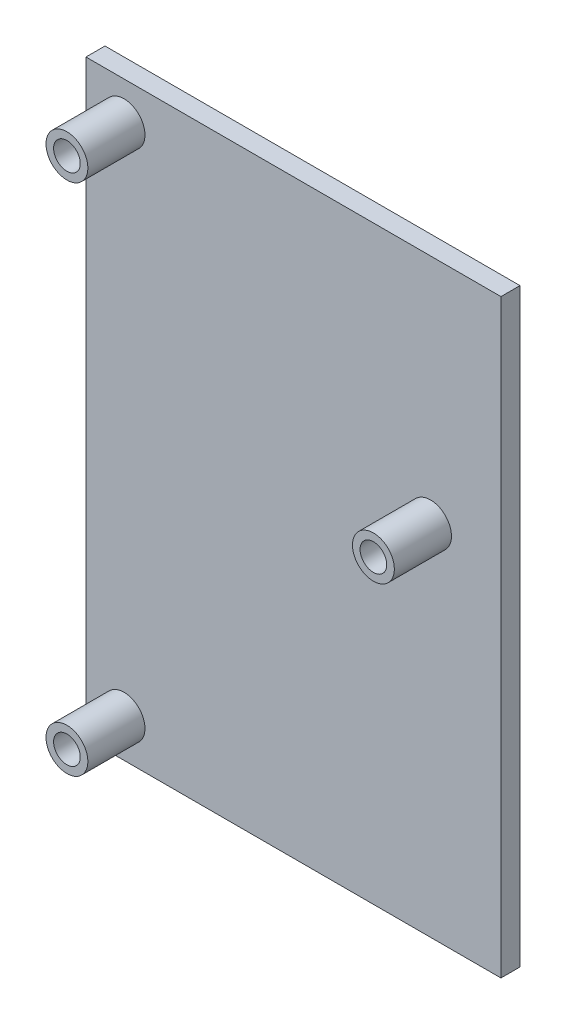
from build123d import *

# Parameters (mm, degrees)
SKETCH1_W           = 77.5
SKETCH1_H           = 54.5
BOSS_EXTRUDE1_DEPTH = 2.5
SKETCH1_5_R         = 2.75
SKETCH1_5_R_2       = 1.75
BOSS_EXTRUDE2_DEPTH = 7.5


with BuildPart() as part:
    # Sketch1 → Boss-Extrude1 (new body)
    with BuildSketch(Plane(origin=(0, 0, 0), x_dir=(0, 1, 0), z_dir=(0, 0, 1))):
        Rectangle(SKETCH1_W, SKETCH1_H)
    extrude(amount=-BOSS_EXTRUDE1_DEPTH)

    # Sketch1<5> → Boss-Extrude2 (add)
    # profile 1 of 3: a face of its own
    with BuildSketch(Plane(origin=(0, 0, 0), x_dir=(0, 1, 0), z_dir=(0, 0, 1))):
        with Locations((-33.75, 22.25)):
            Circle(SKETCH1_5_R)
        with Locations((-33.75, 22.25)):
            Circle(SKETCH1_5_R_2, mode=Mode.SUBTRACT)
    # profile 2 of 3: a face of its own
    with BuildSketch(Plane(origin=(0, 0, 0), x_dir=(0, 1, 0), z_dir=(0, 0, 1))):
        with Locations((33.75, 22.25)):
            Circle(SKETCH1_5_R)
        with Locations((33.75, 22.25)):
            Circle(SKETCH1_5_R_2, mode=Mode.SUBTRACT)
    # profile 3 of 3: a face of its own
    with BuildSketch(Plane(origin=(0, 0, 0), x_dir=(0, 1, 0), z_dir=(0, 0, 1))):
        with Locations((8.25, -18)):
            Circle(SKETCH1_5_R)
        with Locations((8.25, -18)):
            Circle(SKETCH1_5_R_2, mode=Mode.SUBTRACT)
    extrude(amount=BOSS_EXTRUDE2_DEPTH)


solid = part.part
